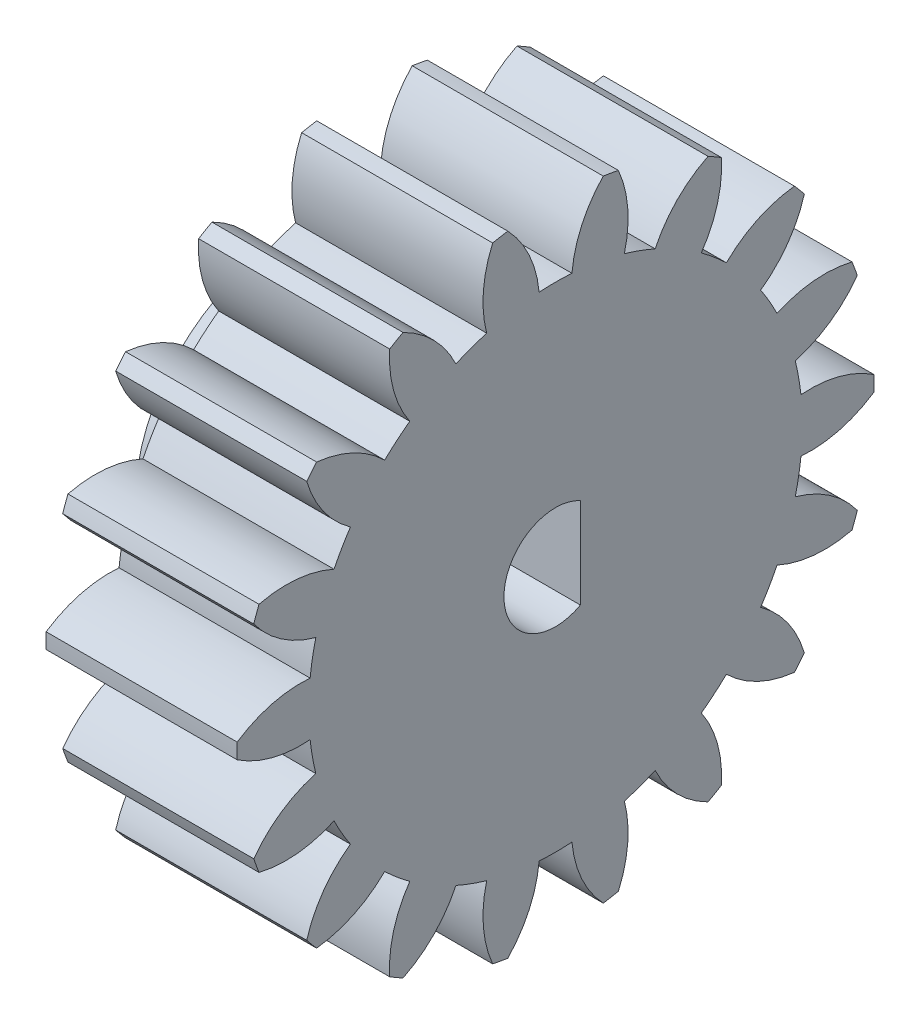
from build123d import *

# Parameters (mm, degrees)
BASPROSKE_W         = 6.35
BASPROSKE_H         = 10.583333333
TOOTHCUT_DEPTH      = 17.258425166
TEETHCUTS_COUNT     = 18
TEETHCUTS_ANGLE     = 340
BORSKE_R            = 0.396875
BORE_DEPTH          = 50.8000508
CUT_EXTRUDE1_DEPTH  = 17.180937051
SKETCH2_R           = 5.08
BOSS_EXTRUDE1_DEPTH = 2.54
SKETCH3_R           = 2.032
CUT_EXTRUDE2_DEPTH  = 2.0066


with BuildPart() as part:
    # BasProSke → Base-Revolve (revolve)
    with BuildSketch(Plane(origin=(0, 0, 0), x_dir=(1, 0, 0), z_dir=(0, 1, 0)), mode=Mode.PRIVATE) as base_revolve_sk:
        with Locations((3.175, 5.291666667)):
            Rectangle(BASPROSKE_W, BASPROSKE_H)
    revolve(base_revolve_sk.sketch.rotate(Axis((-10, 0, 0), (1, 0, 0)), 180), axis=Axis((-10, 0, 0), (1, 0, 0)))

    # TooCutSke → ToothCut (cut, through all)
    with BuildSketch(Plane(origin=(0, 0, 0), x_dir=(0, 0, -1), z_dir=(1, 0, 0))):
        with BuildLine():
            ThreePointArc((0.544428341, 8.186116016), (0, 8.2042), (-0.544428341, 8.186116016))
            ThreePointArc((-0.544428341, 8.186116016), (-0.878937427, 9.427133228), (-1.607072268, 10.486302574))
            ThreePointArc((-1.607072268, 10.486302574), (0, 10.608733333), (1.607072268, 10.486302574))
            ThreePointArc((1.607072268, 10.486302574), (0.878937427, 9.427133228), (0.544428341, 8.186116016))
        make_face()
    toothcut = extrude(amount=TOOTHCUT_DEPTH, mode=Mode.SUBTRACT)

    # TeethCuts: ToothCut ×18 about axis
    teethcuts_axis = Axis((-10, 0, 0), (1, 0, 0))
    for i in range(1, TEETHCUTS_COUNT):
        add(toothcut.rotate(teethcuts_axis, i * TEETHCUTS_ANGLE / (TEETHCUTS_COUNT - 1)), mode=Mode.SUBTRACT)

    # BorSke → Bore (cut, symmetric)
    with BuildSketch(Plane(origin=(0, 0, 0), x_dir=(0, 0, -1), z_dir=(1, 0, 0))):
        with Locations(Location((0, 0, 0), (0, 0, 180))):
            Circle(BORSKE_R)
    extrude(amount=BORE_DEPTH, both=True, mode=Mode.SUBTRACT)

    # Sketch1 → Cut-Extrude1 (cut, through all)
    with BuildSketch(Plane(origin=(6.35, 0, 0), x_dir=(0, 0, -1), z_dir=(1, 0, 0))):
        with BuildLine():
            Line((0.8255, -1.502684265), (0.8255, 1.502684265))
            ThreePointArc((0.8255, 1.502684265), (-1.7145, 0), (0.8255, -1.502684265))
        make_face()
    extrude(amount=-CUT_EXTRUDE1_DEPTH, mode=Mode.SUBTRACT)

    # Sketch2 → Boss-Extrude1 (add)
    with BuildSketch(Plane.ZY):
        with Locations(Location((0, 0, 0), (0, 0, 180))):
            Circle(SKETCH2_R)
    extrude(amount=BOSS_EXTRUDE1_DEPTH)

    # Sketch3 → Cut-Extrude2 (cut)
    with BuildSketch(Plane.ZY.offset(2.54)):
        Circle(SKETCH3_R)
    extrude(amount=-CUT_EXTRUDE2_DEPTH, mode=Mode.SUBTRACT)


solid = part.part
